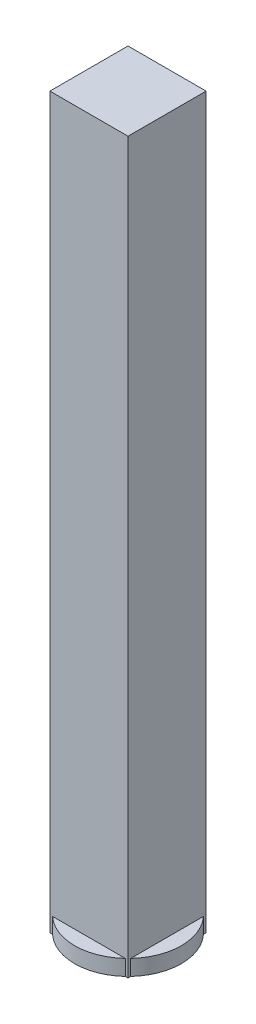
from build123d import *

# Parameters (mm, degrees)
F_01_HOUSING_PROFILE_W        = 60
F_01_HOUSING_PROFILE_H        = 60
F_01_HOUSING_BLOCK_DEPTH      = 560
F_02_FACE_BOSS_PROFILE_R      = 41
F_02_FACE_LOCATING_BOSS_DEPTH = 12


with BuildPart() as part:
    # 01_Housing_Profile → 01_Housing_Block (new body)
    with BuildSketch(Plane(origin=(0, 0, 0), x_dir=(1, 0, 0), z_dir=(0, 1, 0))):
        Rectangle(F_01_HOUSING_PROFILE_W, F_01_HOUSING_PROFILE_H)
    extrude(amount=F_01_HOUSING_BLOCK_DEPTH)

    # 02_Face_Boss_Profile → 02_Face_Locating_Boss (add)
    with BuildSketch(Plane(origin=(0, 0, 0), x_dir=(1, 0, 0), z_dir=(0, 1, 0))):
        Circle(F_02_FACE_BOSS_PROFILE_R)
    extrude(amount=F_02_FACE_LOCATING_BOSS_DEPTH)


solid = part.part
